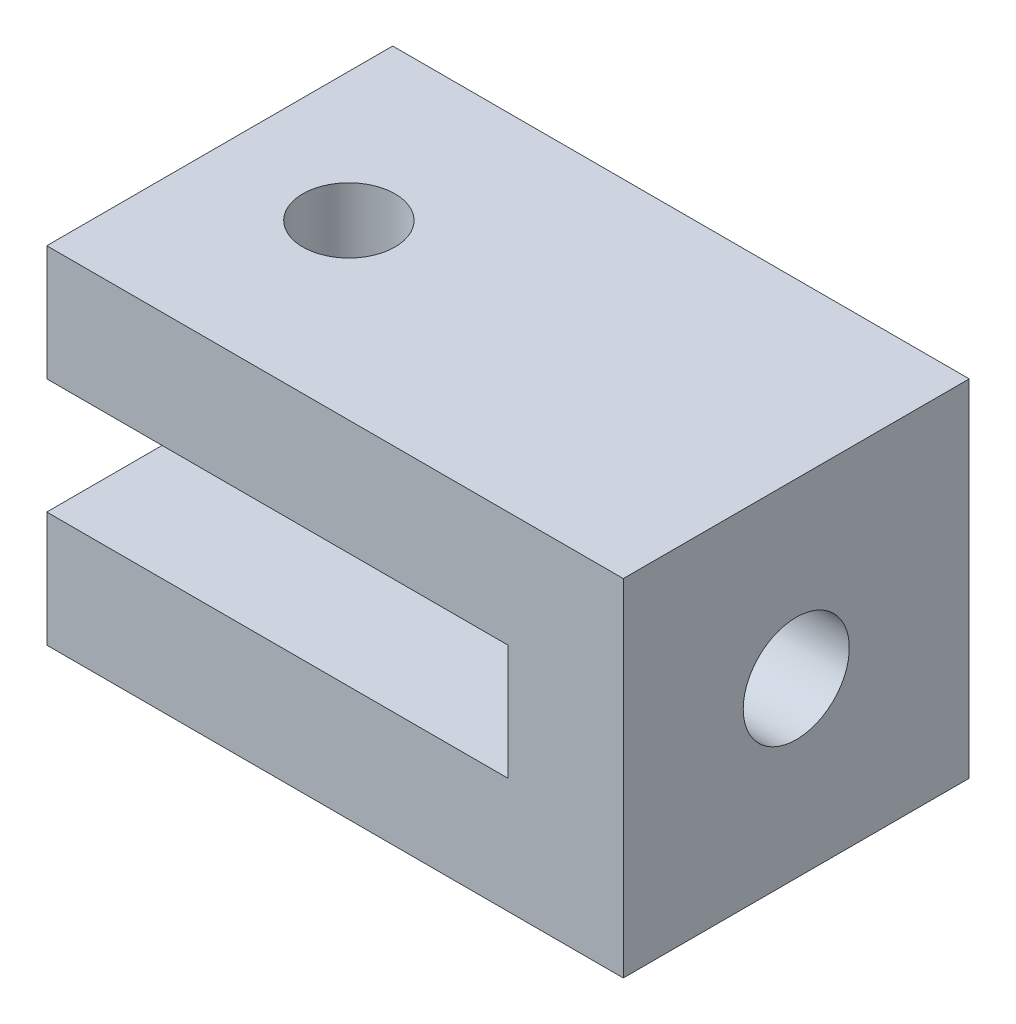
from build123d import *

# Parameters (mm, degrees)
SKETCH1_W           = 15.875
SKETCH1_H           = 9.525
BOSS_EXTRUDE1_DEPTH = 9.525
SKETCH2_W           = 9.525
SKETCH2_H           = 3.175
CUT_EXTRUDE1_DEPTH  = 12.7
SKETCH3_R           = 1.27
CUT_EXTRUDE2_DEPTH  = 9.525
SKETCH4_R           = 1.4605
CUT_EXTRUDE3_DEPTH  = 3.175


with BuildPart() as part:
    # Sketch1 → Boss-Extrude1 (new body)
    with BuildSketch(Plane(origin=(0, 0, 0), x_dir=(1, 0, 0), z_dir=(0, 1, 0))):
        Rectangle(SKETCH1_W, SKETCH1_H)
    extrude(amount=BOSS_EXTRUDE1_DEPTH)

    # Sketch2 → Cut-Extrude1 (cut)
    with BuildSketch(Plane.ZY.offset(7.9375)):
        with Locations((0, 4.7625)):
            Rectangle(SKETCH2_W, SKETCH2_H)
    extrude(amount=-CUT_EXTRUDE1_DEPTH, mode=Mode.SUBTRACT)

    # Sketch3 → Cut-Extrude2 (cut)
    with BuildSketch(Plane.XZ):
        with Locations(Location((-4.3815, 0, 0), (0, 0, 270))):
            Circle(SKETCH3_R)
    extrude(amount=-CUT_EXTRUDE2_DEPTH, mode=Mode.SUBTRACT)

    # Sketch4 → Cut-Extrude3 (cut)
    with BuildSketch(Plane.ZY.offset(-4.7625)):
        with Locations((0, 4.7625)):
            Circle(SKETCH4_R)
    extrude(amount=-CUT_EXTRUDE3_DEPTH, mode=Mode.SUBTRACT)


solid = part.part
